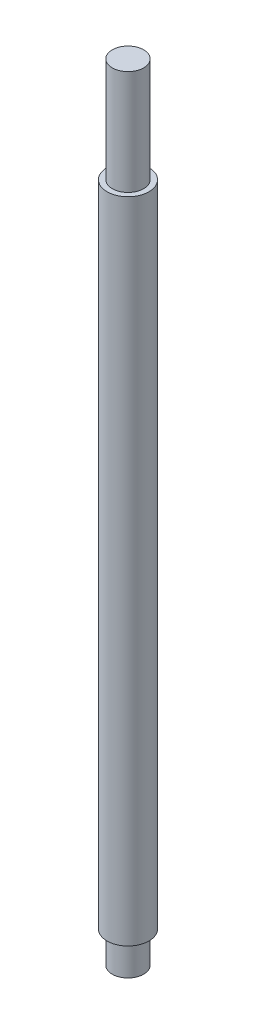
from build123d import *

# Parameters (mm, degrees)
SKETCH1_R           = 2
BOSS_EXTRUDE1_DEPTH = 62
SKETCH2_R           = 1.5
BOSS_EXTRUDE2_DEPTH = 10
BOSS_EXTRUDE3_START = 3
SKETCH3_R           = 1.5
BOSS_EXTRUDE3_DEPTH = 3


with BuildPart() as part:
    # Sketch1 → Boss-Extrude1 (new body)
    with BuildSketch(Plane(origin=(0, 0, 0), x_dir=(1, 0, 0), z_dir=(0, 1, 0))):
        with Locations(Location((0, 0, 0), (0, 0, 270))):
            Circle(SKETCH1_R)
    extrude(amount=BOSS_EXTRUDE1_DEPTH)

    # Sketch2 → Boss-Extrude2 (add)
    with BuildSketch(Plane(origin=(0, 62, 0), x_dir=(1, 0, 0), z_dir=(0, 1, 0))):
        with Locations(Location((0, 0, 0), (0, 0, 270))):
            Circle(SKETCH2_R)
    extrude(amount=BOSS_EXTRUDE2_DEPTH)

    # Sketch3 → Boss-Extrude3 (add)
    with BuildSketch(Plane.XZ.offset(BOSS_EXTRUDE3_START)):
        with Locations(Location((0, 0, 0), (0, 0, 90))):
            Circle(SKETCH3_R)
    extrude(amount=-BOSS_EXTRUDE3_DEPTH)


solid = part.part
